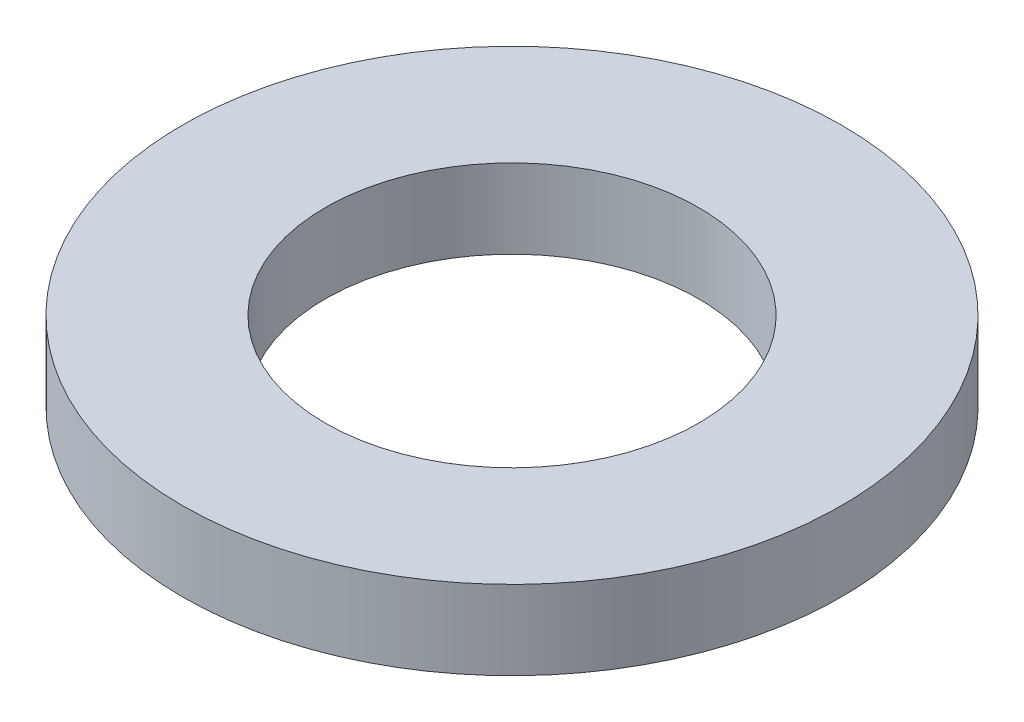
from build123d import *

# Parameters (mm, degrees)
SKETCH1_R           = 7.5
SKETCH1_R_2         = 4.25
BOSS_EXTRUDE1_DEPTH = 1.8


with BuildPart() as part:
    # Sketch1 → Boss-Extrude1 (new body)
    with BuildSketch(Plane(origin=(0, 0, 0), x_dir=(1, 0, 0), z_dir=(0, 1, 0))):
        with Locations(Location((0, 0, 0), (0, 0, 270))):
            Circle(SKETCH1_R)
        with Locations(Location((0, 0, 0), (0, 0, 270))):
            Circle(SKETCH1_R_2, mode=Mode.SUBTRACT)
    extrude(amount=BOSS_EXTRUDE1_DEPTH)


solid = part.part
